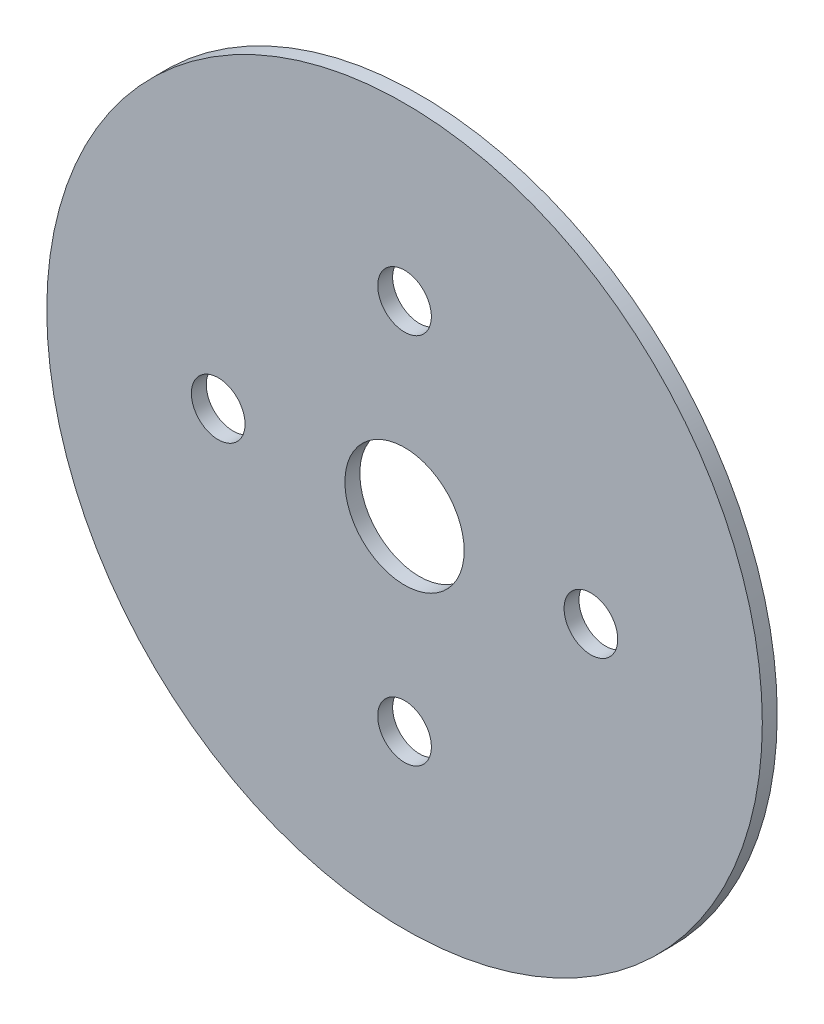
from build123d import *

# Parameters (mm, degrees)
SKETCH1_R           = 30.48
SKETCH1_R_2         = 5.08
SKETCH1_R_3         = 2.286
BOSS_EXTRUDE1_DEPTH = 1.27


with BuildPart() as part:
    # Sketch1 → Boss-Extrude1 (new body)
    with BuildSketch(Plane.XY):
        Circle(SKETCH1_R)
        Circle(SKETCH1_R_2, mode=Mode.SUBTRACT)
        with Locations((0, 15.875)):
            Circle(SKETCH1_R_3, mode=Mode.SUBTRACT)
        with Locations((15.875, 0)):
            Circle(SKETCH1_R_3, mode=Mode.SUBTRACT)
        with Locations((0, -15.875)):
            Circle(SKETCH1_R_3, mode=Mode.SUBTRACT)
        with Locations((-15.875, 0)):
            Circle(SKETCH1_R_3, mode=Mode.SUBTRACT)
    extrude(amount=BOSS_EXTRUDE1_DEPTH)


solid = part.part
